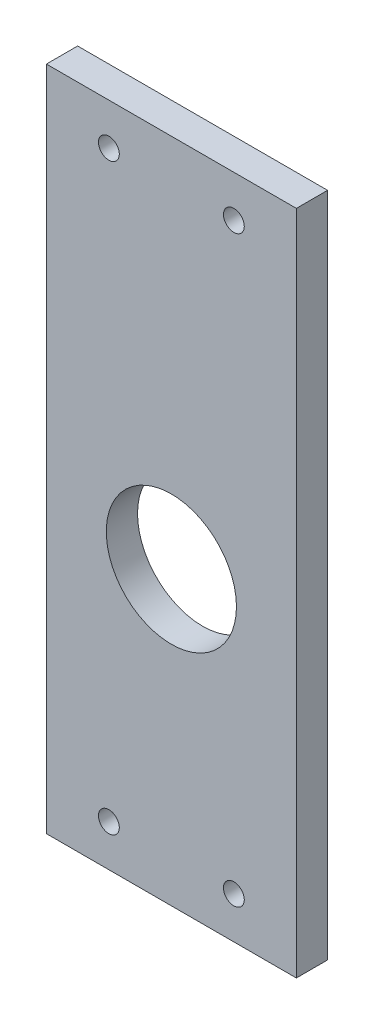
from build123d import *

# Parameters (mm, degrees)
SKETCH1_W           = 76.2
SKETCH1_H           = 203.2
BOSS_EXTRUDE1_DEPTH = 9.525
SKETCH2_R           = 19.84375
CUT_EXTRUDE1_DEPTH  = 9.525
SKETCH3_R           = 3.175
CUT_EXTRUDE2_DEPTH  = 9.525


with BuildPart() as part:
    # Sketch1 → Boss-Extrude1 (new body)
    with BuildSketch(Plane.XY):
        with Locations((38.1, 101.6)):
            Rectangle(SKETCH1_W, SKETCH1_H)
    extrude(amount=BOSS_EXTRUDE1_DEPTH)

    # Sketch2 → Cut-Extrude1 (cut)
    with BuildSketch(Plane.XY.offset(9.525)):
        with Locations((38.1, 88.9)):
            Circle(SKETCH2_R)
    extrude(amount=-CUT_EXTRUDE1_DEPTH, mode=Mode.SUBTRACT)

    # Sketch3 → Cut-Extrude2 (cut)
    with BuildSketch(Plane.XY.offset(9.525)):
        with Locations((19.05, 190.5)):
            Circle(SKETCH3_R)
        with Locations((57.15, 190.5)):
            Circle(SKETCH3_R)
        with Locations((19.05, 12.7)):
            Circle(SKETCH3_R)
        with Locations((57.15, 12.7)):
            Circle(SKETCH3_R)
    extrude(amount=-CUT_EXTRUDE2_DEPTH, mode=Mode.SUBTRACT)


solid = part.part
